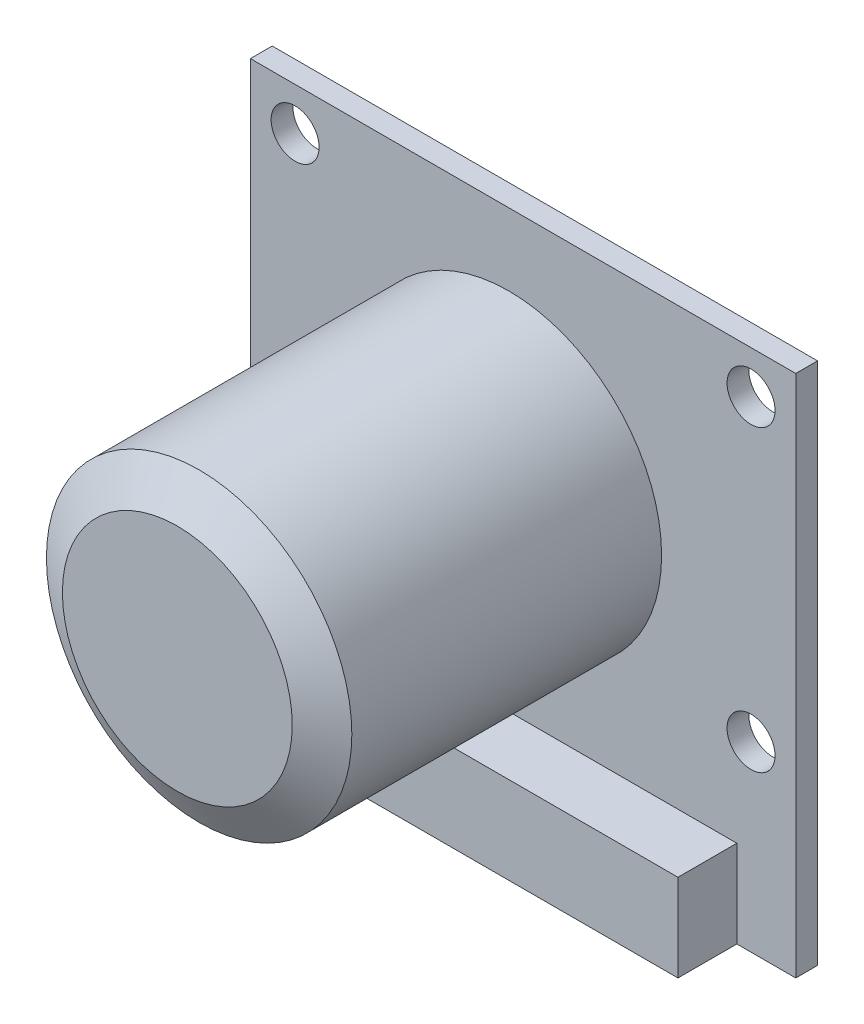
from build123d import *

# Parameters (mm, degrees)
ESBO_O1_W                  = 25
ESBO_O1_H                  = 24
RESSALTO_EXTRUS_O1_DEPTH   = 1
ESBO_O2_W                  = 20.4
ESBO_O2_H                  = 4
RESSALTO_EXTRUS_O2_DEPTH   = 2.7
CORTE_EXTRUS_O1_DEPTH      = 18.536818412
CORTE_EXTRUS_O1_DEPTH_BACK = 18.536818412
ESBO_O3_R                  = 1.1
ESBO_O4_R                  = 7
RESSALTO_EXTRUS_O3_DEPTH   = 15.2
CHANFRO1_SIZE              = 1
CHANFRO1_SIZE2             = 1.732050808


with BuildPart() as part:
    # Esboço1 → Ressalto-extrusão1 (new body)
    with BuildSketch(Plane.XY):
        Rectangle(ESBO_O1_W, ESBO_O1_H)
    extrude(amount=RESSALTO_EXTRUS_O1_DEPTH)

    # Esboço2 → Ressalto-extrusão2 (add)
    with BuildSketch(Plane.XY.offset(1)):
        with Locations((-0.4, -10)):
            Rectangle(ESBO_O2_W, ESBO_O2_H)
    extrude(amount=RESSALTO_EXTRUS_O2_DEPTH)

    # Esboço3 → Corte-extrusão1 (cut, two sides: drawn at the far end of the back side and taken through both)
    with BuildSketch(Plane.XY.offset(1).offset(-CORTE_EXTRUS_O1_DEPTH_BACK)):
        with Locations((10.45, 10.05)):
            Circle(ESBO_O3_R)
        with Locations((-10.45, 10.05)):
            Circle(ESBO_O3_R)
        with Locations((10.45, -3.65)):
            Circle(ESBO_O3_R)
        with Locations((-10.45, -3.65)):
            Circle(ESBO_O3_R)
    extrude(amount=CORTE_EXTRUS_O1_DEPTH + CORTE_EXTRUS_O1_DEPTH_BACK, mode=Mode.SUBTRACT)

    # Esboço4 → Ressalto-extrusão3 (add)
    with BuildSketch(Plane.XY.offset(1)):
        with Locations(Location((-0.65, 1.7, 0), (0, 0, 180))):
            Circle(ESBO_O4_R)
    extrude(amount=RESSALTO_EXTRUS_O3_DEPTH)

    # Chanfro1
    chanfro1_edges = [part.edges().sort_by_distance(p)[0] for p in [
        (6.35, 1.7, 16.2),
    ]]
    chanfro1_side = [part.faces().sort_by_distance(p)[0] for p in [
        (6.35, 1.7, 8.6),
    ]]
    chamfer(chanfro1_edges, length=CHANFRO1_SIZE, length2=CHANFRO1_SIZE2, reference=chanfro1_side[0])


solid = part.part
